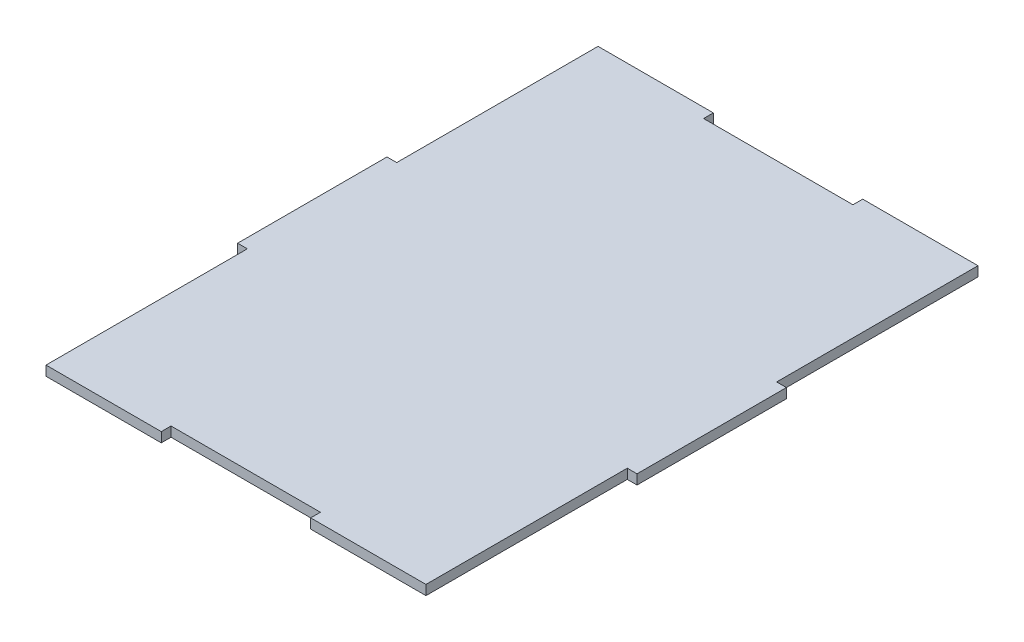
from build123d import *

# Parameters (mm, degrees)
SALIENTE_EXTRUIR1_DEPTH = 3


with BuildPart() as part:
    # Croquis1 → Saliente-Extruir1 (new body)
    with BuildSketch(Plane(origin=(0, 0, 0), x_dir=(1, 0, 0), z_dir=(0, 1, 0))):
        Polygon((84.5, 170), (120, 170), (120, 108), (123, 108), (123, 62), (120, 62), (120, 0), (84.5, 0), (84.5, 3), (38.5, 3), (38.5, 0), (3, 0), (3, 62), (0, 62), (0, 108), (3, 108), (3, 170), (38.5, 170), (38.5, 167), (84.5, 167), align=None)
    extrude(amount=SALIENTE_EXTRUIR1_DEPTH)


solid = part.part
